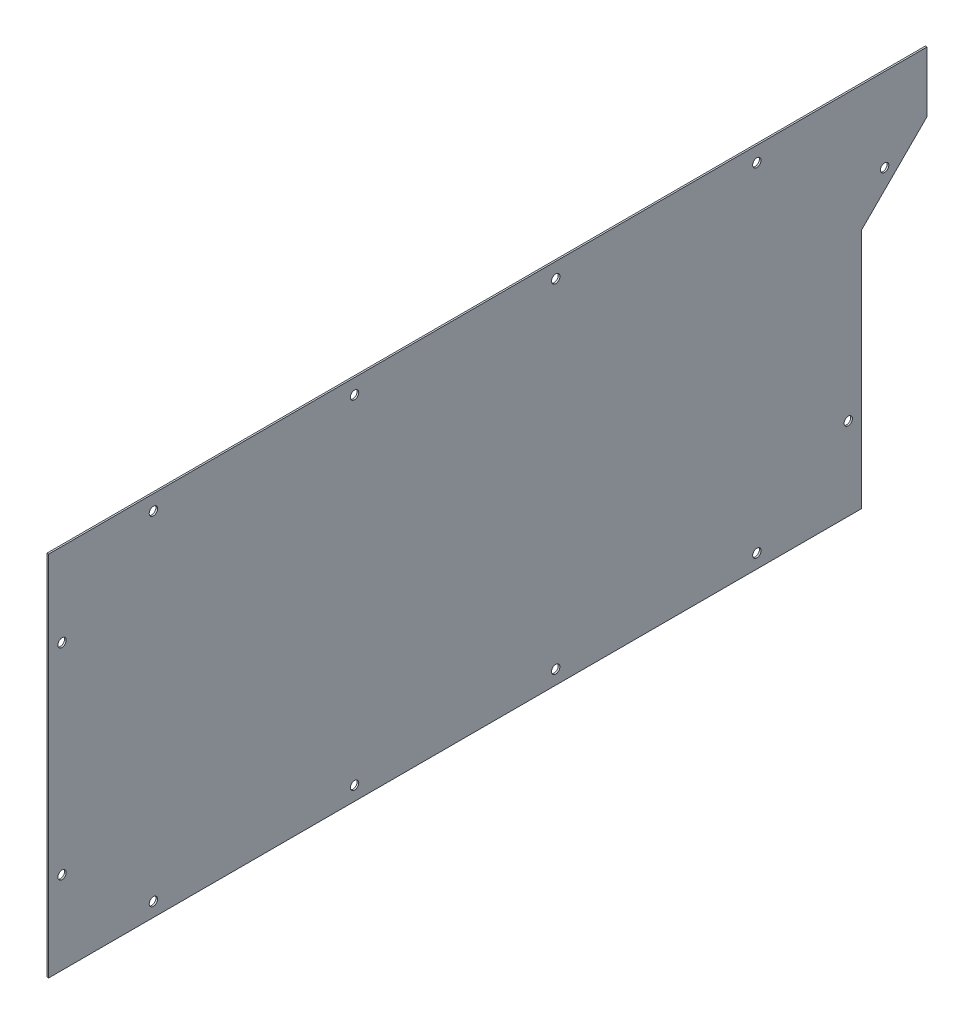
from build123d import *

# Parameters (mm, degrees)
EXTRUDE_1_DEPTH     = 1
CUT_EXTRUDE_1_REACH = 285.963
SKETCH_2_R          = 2.5


with BuildPart() as part:
    # Эскиз1 → Бобышка-Вытянуть1 (new body)
    with BuildSketch(Plane(origin=(0, 0, 0), x_dir=(0, 0, -1), z_dir=(1, 0, 0))):
        Polygon((223, -109.5), (223, 34.5), (262, 73.5), (262, 109.5), (-262, 109.5), (-262, -109.5), align=None)
    extrude(amount=EXTRUDE_1_DEPTH)

    # Эскиз2 → Вырез-Вытянуть1 (cut, up to next)
    with BuildSketch(Plane(origin=(1, 0, 0), x_dir=(0, 0, -1), z_dir=(1, 0, 0)), mode=Mode.PRIVATE) as cut_extrude_1_sk1:
        with Locations((40.5, -101.207106781)):
            Circle(SKETCH_2_R)
    cut_extrude_1_tool1 = extrude(cut_extrude_1_sk1.sketch, amount=-CUT_EXTRUDE_1_REACH, mode=Mode.PRIVATE) & part.part
    # Эскиз2 → Вырез-Вытянуть1 (cut, up to next)
    with BuildSketch(Plane(origin=(1, 0, 0), x_dir=(0, 0, -1), z_dir=(1, 0, 0)), mode=Mode.PRIVATE) as cut_extrude_1_sk2:
        with Locations((160.5, -101.207106781)):
            Circle(SKETCH_2_R)
    cut_extrude_1_tool2 = extrude(cut_extrude_1_sk2.sketch, amount=-CUT_EXTRUDE_1_REACH, mode=Mode.PRIVATE) & part.part
    # Эскиз2 → Вырез-Вытянуть1 (cut, up to next)
    with BuildSketch(Plane(origin=(1, 0, 0), x_dir=(0, 0, -1), z_dir=(1, 0, 0)), mode=Mode.PRIVATE) as cut_extrude_1_sk3:
        with Locations((-79.5, -101.207106781)):
            Circle(SKETCH_2_R)
    cut_extrude_1_tool3 = extrude(cut_extrude_1_sk3.sketch, amount=-CUT_EXTRUDE_1_REACH, mode=Mode.PRIVATE) & part.part
    # Эскиз2 → Вырез-Вытянуть1 (cut, up to next)
    with BuildSketch(Plane(origin=(1, 0, 0), x_dir=(0, 0, -1), z_dir=(1, 0, 0)), mode=Mode.PRIVATE) as cut_extrude_1_sk4:
        with Locations((-199.5, -101.207106781)):
            Circle(SKETCH_2_R)
    cut_extrude_1_tool4 = extrude(cut_extrude_1_sk4.sketch, amount=-CUT_EXTRUDE_1_REACH, mode=Mode.PRIVATE) & part.part
    # Эскиз2 → Вырез-Вытянуть1 (cut, up to next)
    with BuildSketch(Plane(origin=(1, 0, 0), x_dir=(0, 0, -1), z_dir=(1, 0, 0)), mode=Mode.PRIVATE) as cut_extrude_1_sk5:
        with Locations((215, -60.207106781)):
            Circle(SKETCH_2_R)
    cut_extrude_1_tool5 = extrude(cut_extrude_1_sk5.sketch, amount=-CUT_EXTRUDE_1_REACH, mode=Mode.PRIVATE) & part.part
    # Эскиз2 → Вырез-Вытянуть1 (cut, up to next)
    with BuildSketch(Plane(origin=(1, 0, 0), x_dir=(0, 0, -1), z_dir=(1, 0, 0)), mode=Mode.PRIVATE) as cut_extrude_1_sk6:
        with Locations((236.686291501, 59.792893219)):
            Circle(SKETCH_2_R)
    cut_extrude_1_tool6 = extrude(cut_extrude_1_sk6.sketch, amount=-CUT_EXTRUDE_1_REACH, mode=Mode.PRIVATE) & part.part
    # Эскиз2 → Вырез-Вытянуть1 (cut, up to next)
    with BuildSketch(Plane(origin=(1, 0, 0), x_dir=(0, 0, -1), z_dir=(1, 0, 0)), mode=Mode.PRIVATE) as cut_extrude_1_sk7:
        with Locations((-254, 59.792893219)):
            Circle(SKETCH_2_R)
    cut_extrude_1_tool7 = extrude(cut_extrude_1_sk7.sketch, amount=-CUT_EXTRUDE_1_REACH, mode=Mode.PRIVATE) & part.part
    # Эскиз2 → Вырез-Вытянуть1 (cut, up to next)
    with BuildSketch(Plane(origin=(1, 0, 0), x_dir=(0, 0, -1), z_dir=(1, 0, 0)), mode=Mode.PRIVATE) as cut_extrude_1_sk8:
        with Locations((-254, -60.207106781)):
            Circle(SKETCH_2_R)
    cut_extrude_1_tool8 = extrude(cut_extrude_1_sk8.sketch, amount=-CUT_EXTRUDE_1_REACH, mode=Mode.PRIVATE) & part.part
    # Эскиз2 → Вырез-Вытянуть1 (cut, up to next)
    with BuildSketch(Plane(origin=(1, 0, 0), x_dir=(0, 0, -1), z_dir=(1, 0, 0)), mode=Mode.PRIVATE) as cut_extrude_1_sk9:
        with Locations((-199.5, 100.5)):
            Circle(SKETCH_2_R)
    cut_extrude_1_tool9 = extrude(cut_extrude_1_sk9.sketch, amount=-CUT_EXTRUDE_1_REACH, mode=Mode.PRIVATE) & part.part
    # Эскиз2 → Вырез-Вытянуть1 (cut, up to next)
    with BuildSketch(Plane(origin=(1, 0, 0), x_dir=(0, 0, -1), z_dir=(1, 0, 0)), mode=Mode.PRIVATE) as cut_extrude_1_sk10:
        with Locations((-79.5, 100.5)):
            Circle(SKETCH_2_R)
    cut_extrude_1_tool10 = extrude(cut_extrude_1_sk10.sketch, amount=-CUT_EXTRUDE_1_REACH, mode=Mode.PRIVATE) & part.part
    # Эскиз2 → Вырез-Вытянуть1 (cut, up to next)
    with BuildSketch(Plane(origin=(1, 0, 0), x_dir=(0, 0, -1), z_dir=(1, 0, 0)), mode=Mode.PRIVATE) as cut_extrude_1_sk11:
        with Locations((40.5, 100.5)):
            Circle(SKETCH_2_R)
    cut_extrude_1_tool11 = extrude(cut_extrude_1_sk11.sketch, amount=-CUT_EXTRUDE_1_REACH, mode=Mode.PRIVATE) & part.part
    # Эскиз2 → Вырез-Вытянуть1 (cut, up to next)
    with BuildSketch(Plane(origin=(1, 0, 0), x_dir=(0, 0, -1), z_dir=(1, 0, 0)), mode=Mode.PRIVATE) as cut_extrude_1_sk12:
        with Locations((160.5, 100.5)):
            Circle(SKETCH_2_R)
    cut_extrude_1_tool12 = extrude(cut_extrude_1_sk12.sketch, amount=-CUT_EXTRUDE_1_REACH, mode=Mode.PRIVATE) & part.part
    add(cut_extrude_1_tool1.solids().sort_by_distance((1, -101.207107, -40.5))[0], mode=Mode.SUBTRACT)
    add(cut_extrude_1_tool2.solids().sort_by_distance((1, -101.207107, -160.5))[0], mode=Mode.SUBTRACT)
    add(cut_extrude_1_tool3.solids().sort_by_distance((1, -101.207107, 79.5))[0], mode=Mode.SUBTRACT)
    add(cut_extrude_1_tool4.solids().sort_by_distance((1, -101.207107, 199.5))[0], mode=Mode.SUBTRACT)
    add(cut_extrude_1_tool5.solids().sort_by_distance((1, -60.207107, -215))[0], mode=Mode.SUBTRACT)
    add(cut_extrude_1_tool6.solids().sort_by_distance((1, 59.792893, -236.686292))[0], mode=Mode.SUBTRACT)
    add(cut_extrude_1_tool7.solids().sort_by_distance((1, 59.792893, 254))[0], mode=Mode.SUBTRACT)
    add(cut_extrude_1_tool8.solids().sort_by_distance((1, -60.207107, 254))[0], mode=Mode.SUBTRACT)
    add(cut_extrude_1_tool9.solids().sort_by_distance((1, 100.5, 199.5))[0], mode=Mode.SUBTRACT)
    add(cut_extrude_1_tool10.solids().sort_by_distance((1, 100.5, 79.5))[0], mode=Mode.SUBTRACT)
    add(cut_extrude_1_tool11.solids().sort_by_distance((1, 100.5, -40.5))[0], mode=Mode.SUBTRACT)
    add(cut_extrude_1_tool12.solids().sort_by_distance((1, 100.5, -160.5))[0], mode=Mode.SUBTRACT)


solid = part.part
